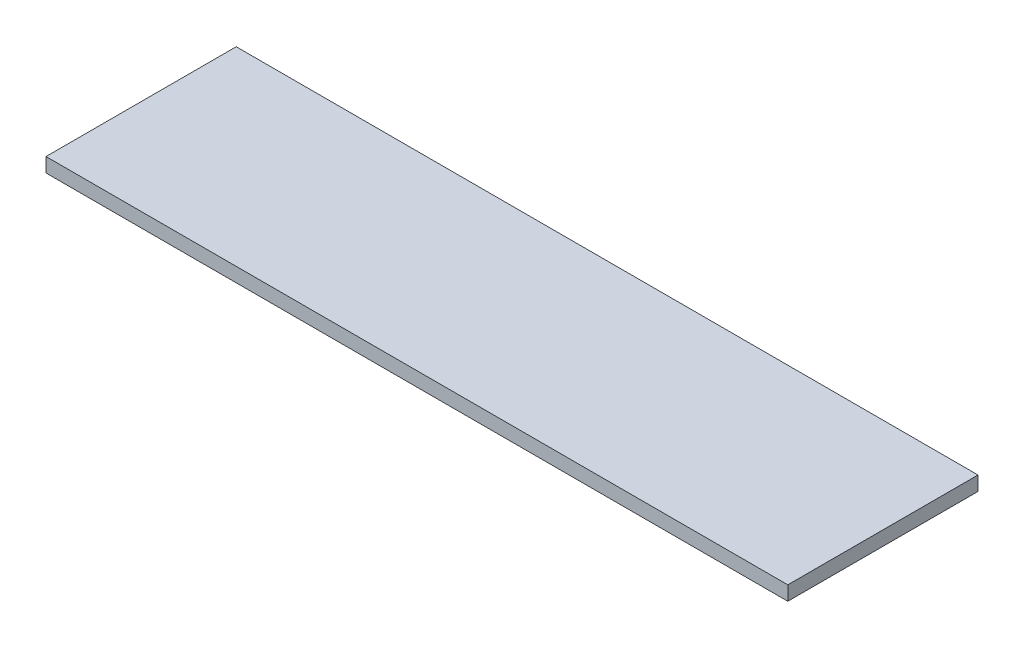
from build123d import *

# Parameters (mm, degrees)
SKETCH1_W           = 990.6
SKETCH1_H           = 254
BOSS_EXTRUDE1_DEPTH = 19.05


with BuildPart() as part:
    # Sketch1 → Boss-Extrude1 (new body)
    with BuildSketch(Plane(origin=(0, 0, 0), x_dir=(1, 0, 0), z_dir=(0, 1, 0))):
        with Locations((495.3, -127)):
            Rectangle(SKETCH1_W, SKETCH1_H)
    extrude(amount=BOSS_EXTRUDE1_DEPTH)


solid = part.part
